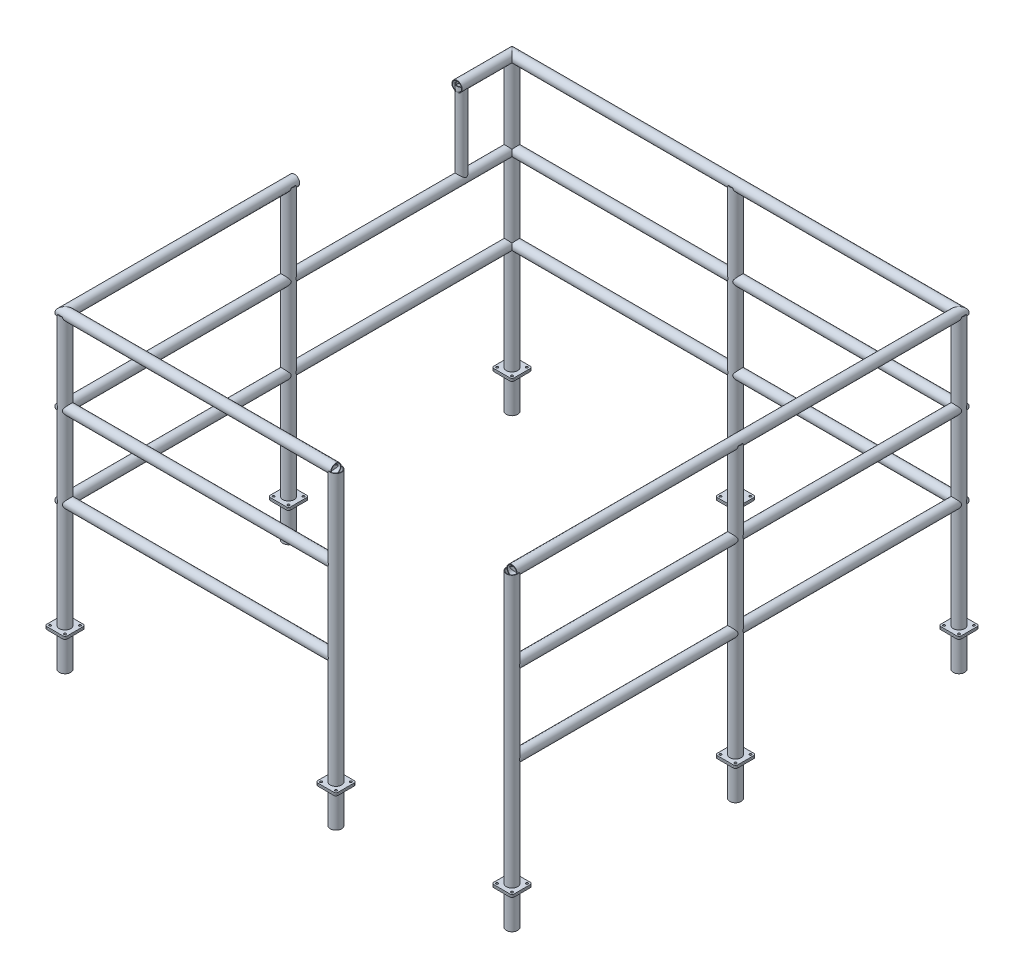
from build123d import *

# Parameters (mm, degrees)
SWEEP_THIN6_PROFILE_R   = 19
SWEEP_THIN6_PROFILE_R_2 = 17
LPATTERN1_COUNT         = 3
LPATTERN1_PITCH         = 300
SKETCH46_R              = 21
SKETCH46_R_2            = 19
BOSS_EXTRUDE5_DEPTH     = 1000
BOSS_EXTRUDE5_2_DEPTH   = 1000
BOSS_EXTRUDE5_3_DEPTH   = 1000
BOSS_EXTRUDE5_4_DEPTH   = 1000
BOSS_EXTRUDE5_5_DEPTH   = 1000
BOSS_EXTRUDE5_6_DEPTH   = 1000
BOSS_EXTRUDE5_7_DEPTH   = 1000
BOSS_EXTRUDE5_8_DEPTH   = 1000
SKETCH47_R              = 4
BOSS_EXTRUDE6_DEPTH     = 5
BOSS_EXTRUDE6_2_DEPTH   = 5
BOSS_EXTRUDE6_3_DEPTH   = 5
BOSS_EXTRUDE6_4_DEPTH   = 5
BOSS_EXTRUDE6_5_DEPTH   = 5
BOSS_EXTRUDE6_6_DEPTH   = 5
BOSS_EXTRUDE6_7_DEPTH   = 5
BOSS_EXTRUDE6_8_DEPTH   = 5
SKETCH55_R              = 4
BOSS_EXTRUDE7_DEPTH     = 5
BOSS_EXTRUDE7_2_DEPTH   = 5
BOSS_EXTRUDE7_3_DEPTH   = 5
BOSS_EXTRUDE7_4_DEPTH   = 5
BOSS_EXTRUDE7_5_DEPTH   = 5
BOSS_EXTRUDE7_6_DEPTH   = 5
BOSS_EXTRUDE7_7_DEPTH   = 5
BOSS_EXTRUDE7_8_DEPTH   = 5
SKETCH60_R              = 21
SKETCH60_R_2            = 19
BOSS_EXTRUDE8_DEPTH     = 130
BOSS_EXTRUDE8_2_DEPTH   = 130
BOSS_EXTRUDE8_3_DEPTH   = 130
BOSS_EXTRUDE8_4_DEPTH   = 130
BOSS_EXTRUDE8_5_DEPTH   = 130
BOSS_EXTRUDE8_6_DEPTH   = 130
BOSS_EXTRUDE8_7_DEPTH   = 130
BOSS_EXTRUDE8_8_DEPTH   = 130
CUT_EXTRUDE1_DEPTH      = 20
CUT_EXTRUDE1_DEPTH_BACK = 20
SKETCH64_W              = 38
SKETCH64_H              = 600
SKETCH66_R              = 17
SKETCH66_R_2            = 15
BOSS_EXTRUDE9_DEPTH     = 304


with BuildPart() as part:
    # Sweep-Thin6: sweep along a path in Sketch33
    with BuildLine(Plane(origin=(0, 0, 0), x_dir=(1, 0, 0), z_dir=(0, 1, 0))) as sweep_thin6_path:
        Line((825, -825), (825, 825))
        Line((825, 825), (-825, 825))
        Line((-825, 825), (-825, -825))
        Line((-825, -825), (175, -825))
    # Sweep-Thin6 profile (on start of the path) → Sweep-Thin6 (sweep)
    with BuildSketch(Plane(origin=(825, 0, 825), x_dir=(-1, 0, 0), z_dir=(0, 0, -1))):
        Circle(SWEEP_THIN6_PROFILE_R)
        Circle(SWEEP_THIN6_PROFILE_R_2, mode=Mode.SUBTRACT)
    sweep(path=sweep_thin6_path.line, transition=Transition.RIGHT)


with BuildPart() as lpattern1_1:
    # LPattern1: pattern copy
    add(part.part.moved(Location(Vector(0, -1, 0) * (1 * LPATTERN1_PITCH))))



with BuildPart() as lpattern1_2:
    # LPattern1: pattern copy
    add(part.part.moved(Location(Vector(0, -1, 0) * (2 * LPATTERN1_PITCH))))


with BuildPart() as body_4:
    # Sketch46 → Boss-Extrude5 (new body)
    with BuildSketch(Plane(origin=(0, 0, 0), x_dir=(1, 0, 0), z_dir=(0, 1, 0))):
        with Locations(Location((-825, 825, 0), (0, 0, 270))):
            Circle(SKETCH46_R)
        with Locations(Location((-825, 825, 0), (0, 0, 270))):
            Circle(SKETCH46_R_2, mode=Mode.SUBTRACT)
    extrude(amount=-BOSS_EXTRUDE5_DEPTH)


with BuildPart() as body_5:
    # Sketch46 → Boss-Extrude5 2 (new body)
    with BuildSketch(Plane(origin=(0, 0, 0), x_dir=(1, 0, 0), z_dir=(0, 1, 0))):
        with Locations(Location((0, 825, 0), (0, 0, 270))):
            Circle(SKETCH46_R)
        with Locations(Location((0, 825, 0), (0, 0, 270))):
            Circle(SKETCH46_R_2, mode=Mode.SUBTRACT)
    extrude(amount=-BOSS_EXTRUDE5_2_DEPTH)


with BuildPart() as body_6:
    # Sketch46 → Boss-Extrude5 3 (new body)
    with BuildSketch(Plane(origin=(0, 0, 0), x_dir=(1, 0, 0), z_dir=(0, 1, 0))):
        with Locations(Location((825, 825, 0), (0, 0, 270))):
            Circle(SKETCH46_R)
        with Locations(Location((825, 825, 0), (0, 0, 270))):
            Circle(SKETCH46_R_2, mode=Mode.SUBTRACT)
    extrude(amount=-BOSS_EXTRUDE5_3_DEPTH)


with BuildPart() as body_7:
    # Sketch46 → Boss-Extrude5 4 (new body)
    with BuildSketch(Plane(origin=(0, 0, 0), x_dir=(1, 0, 0), z_dir=(0, 1, 0))):
        with Locations(Location((825, 0, 0), (0, 0, 270))):
            Circle(SKETCH46_R)
        with Locations(Location((825, 0, 0), (0, 0, 270))):
            Circle(SKETCH46_R_2, mode=Mode.SUBTRACT)
    extrude(amount=-BOSS_EXTRUDE5_4_DEPTH)


with BuildPart() as body_8:
    # Sketch46 → Boss-Extrude5 5 (new body)
    with BuildSketch(Plane(origin=(0, 0, 0), x_dir=(1, 0, 0), z_dir=(0, 1, 0))):
        with Locations(Location((825, -825, 0), (0, 0, 270))):
            Circle(SKETCH46_R)
        with Locations(Location((825, -825, 0), (0, 0, 270))):
            Circle(SKETCH46_R_2, mode=Mode.SUBTRACT)
    extrude(amount=-BOSS_EXTRUDE5_5_DEPTH)


with BuildPart() as body_9:
    # Sketch46 → Boss-Extrude5 6 (new body)
    with BuildSketch(Plane(origin=(0, 0, 0), x_dir=(1, 0, 0), z_dir=(0, 1, 0))):
        with Locations(Location((-825, 0, 0), (0, 0, 270))):
            Circle(SKETCH46_R)
        with Locations(Location((-825, 0, 0), (0, 0, 270))):
            Circle(SKETCH46_R_2, mode=Mode.SUBTRACT)
    extrude(amount=-BOSS_EXTRUDE5_6_DEPTH)


with BuildPart() as body_10:
    # Sketch46 → Boss-Extrude5 7 (new body)
    with BuildSketch(Plane(origin=(0, 0, 0), x_dir=(1, 0, 0), z_dir=(0, 1, 0))):
        with Locations(Location((-825, -825, 0), (0, 0, 270))):
            Circle(SKETCH46_R)
        with Locations(Location((-825, -825, 0), (0, 0, 270))):
            Circle(SKETCH46_R_2, mode=Mode.SUBTRACT)
    extrude(amount=-BOSS_EXTRUDE5_7_DEPTH)


with BuildPart() as body_11:
    # Sketch46 → Boss-Extrude5 8 (new body)
    with BuildSketch(Plane(origin=(0, 0, 0), x_dir=(1, 0, 0), z_dir=(0, 1, 0))):
        with Locations(Location((175, -825, 0), (0, 0, 270))):
            Circle(SKETCH46_R)
        with Locations(Location((175, -825, 0), (0, 0, 270))):
            Circle(SKETCH46_R_2, mode=Mode.SUBTRACT)
    extrude(amount=-BOSS_EXTRUDE5_8_DEPTH)


with BuildPart() as body_12:
    # Sketch47 → Boss-Extrude6 (new body)
    with BuildSketch(Plane.XZ.offset(1000)):
        with BuildLine():
            Line((37.5, -795.5), (37.5, -854.5))
            ThreePointArc((37.5, -854.5), (35.156854249, -860.156854249), (29.5, -862.5))
            Line((29.5, -862.5), (-29.5, -862.5))
            ThreePointArc((-29.5, -862.5), (-35.156854249, -860.156854249), (-37.5, -854.5))
            Line((-37.5, -854.5), (-37.5, -795.5))
            ThreePointArc((-37.5, -795.5), (-35.156854249, -789.843145751), (-29.5, -787.5))
            Line((-29.5, -787.5), (29.5, -787.5))
            ThreePointArc((29.5, -787.5), (35.156854249, -789.843145751), (37.5, -795.5))
        make_face()
        with Locations(Location((27.5, -797.5, 0), (0, 0, 270))):
            Circle(SKETCH47_R, mode=Mode.SUBTRACT)
        with Locations(Location((27.5, -852.5, 0), (0, 0, 270))):
            Circle(SKETCH47_R, mode=Mode.SUBTRACT)
        with Locations(Location((-27.5, -797.5, 0), (0, 0, 270))):
            Circle(SKETCH47_R, mode=Mode.SUBTRACT)
        with Locations(Location((-27.5, -852.5, 0), (0, 0, 270))):
            Circle(SKETCH47_R, mode=Mode.SUBTRACT)
    extrude(amount=BOSS_EXTRUDE6_DEPTH)


with BuildPart() as body_13:
    # Sketch47 → Boss-Extrude6 2 (new body)
    with BuildSketch(Plane.XZ.offset(1000)):
        with BuildLine():
            Line((-795.5, -787.5), (-854.5, -787.5))
            ThreePointArc((-854.5, -787.5), (-860.156854249, -789.843145751), (-862.5, -795.5))
            Line((-862.5, -795.5), (-862.5, -854.5))
            ThreePointArc((-862.5, -854.5), (-860.156854249, -860.156854249), (-854.5, -862.5))
            Line((-854.5, -862.5), (-795.5, -862.5))
            ThreePointArc((-795.5, -862.5), (-789.843145751, -860.156854249), (-787.5, -854.5))
            Line((-787.5, -854.5), (-787.5, -795.5))
            ThreePointArc((-787.5, -795.5), (-789.843145751, -789.843145751), (-795.5, -787.5))
        make_face()
        with Locations(Location((-797.5, -797.5, 0), (0, 0, 270))):
            Circle(SKETCH47_R, mode=Mode.SUBTRACT)
        with Locations(Location((-852.5, -797.5, 0), (0, 0, 270))):
            Circle(SKETCH47_R, mode=Mode.SUBTRACT)
        with Locations(Location((-852.5, -852.5, 0), (0, 0, 270))):
            Circle(SKETCH47_R, mode=Mode.SUBTRACT)
        with Locations(Location((-797.5, -852.5, 0), (0, 0, 270))):
            Circle(SKETCH47_R, mode=Mode.SUBTRACT)
    extrude(amount=BOSS_EXTRUDE6_2_DEPTH)


with BuildPart() as body_14:
    # Sketch47 → Boss-Extrude6 3 (new body)
    with BuildSketch(Plane.XZ.offset(1000)):
        with BuildLine():
            Line((862.5, -795.5), (862.5, -854.5))
            ThreePointArc((862.5, -854.5), (860.156854249, -860.156854249), (854.5, -862.5))
            Line((854.5, -862.5), (795.5, -862.5))
            ThreePointArc((795.5, -862.5), (789.843145751, -860.156854249), (787.5, -854.5))
            Line((787.5, -854.5), (787.5, -795.5))
            ThreePointArc((787.5, -795.5), (789.843145751, -789.843145751), (795.5, -787.5))
            Line((795.5, -787.5), (854.5, -787.5))
            ThreePointArc((854.5, -787.5), (860.156854249, -789.843145751), (862.5, -795.5))
        make_face()
        with Locations(Location((852.5, -797.5, 0), (0, 0, 270))):
            Circle(SKETCH47_R, mode=Mode.SUBTRACT)
        with Locations(Location((852.5, -852.5, 0), (0, 0, 270))):
            Circle(SKETCH47_R, mode=Mode.SUBTRACT)
        with Locations(Location((797.5, -797.5, 0), (0, 0, 270))):
            Circle(SKETCH47_R, mode=Mode.SUBTRACT)
        with Locations(Location((797.5, -852.5, 0), (0, 0, 270))):
            Circle(SKETCH47_R, mode=Mode.SUBTRACT)
    extrude(amount=BOSS_EXTRUDE6_3_DEPTH)


with BuildPart() as body_15:
    # Sketch47 → Boss-Extrude6 4 (new body)
    with BuildSketch(Plane.XZ.offset(1000)):
        with BuildLine():
            Line((862.5, 29.5), (862.5, -29.5))
            ThreePointArc((862.5, -29.5), (860.156854249, -35.156854249), (854.5, -37.5))
            Line((854.5, -37.5), (795.5, -37.5))
            ThreePointArc((795.5, -37.5), (789.843145751, -35.156854249), (787.5, -29.5))
            Line((787.5, -29.5), (787.5, 29.5))
            ThreePointArc((787.5, 29.5), (789.843145751, 35.156854249), (795.5, 37.5))
            Line((795.5, 37.5), (854.5, 37.5))
            ThreePointArc((854.5, 37.5), (860.156854249, 35.156854249), (862.5, 29.5))
        make_face()
        with Locations(Location((852.5, 27.5, 0), (0, 0, 270))):
            Circle(SKETCH47_R, mode=Mode.SUBTRACT)
        with Locations(Location((852.5, -27.5, 0), (0, 0, 270))):
            Circle(SKETCH47_R, mode=Mode.SUBTRACT)
        with Locations(Location((797.5, 27.5, 0), (0, 0, 270))):
            Circle(SKETCH47_R, mode=Mode.SUBTRACT)
        with Locations(Location((797.5, -27.5, 0), (0, 0, 270))):
            Circle(SKETCH47_R, mode=Mode.SUBTRACT)
    extrude(amount=BOSS_EXTRUDE6_4_DEPTH)


with BuildPart() as body_16:
    # Sketch47 → Boss-Extrude6 5 (new body)
    with BuildSketch(Plane.XZ.offset(1000)):
        with BuildLine():
            Line((862.5, 854.5), (862.5, 795.5))
            ThreePointArc((862.5, 795.5), (860.156854249, 789.843145751), (854.5, 787.5))
            Line((854.5, 787.5), (795.5, 787.5))
            ThreePointArc((795.5, 787.5), (789.843145751, 789.843145751), (787.5, 795.5))
            Line((787.5, 795.5), (787.5, 854.5))
            ThreePointArc((787.5, 854.5), (789.843145751, 860.156854249), (795.5, 862.5))
            Line((795.5, 862.5), (854.5, 862.5))
            ThreePointArc((854.5, 862.5), (860.156854249, 860.156854249), (862.5, 854.5))
        make_face()
        with Locations(Location((852.5, 852.5, 0), (0, 0, 270))):
            Circle(SKETCH47_R, mode=Mode.SUBTRACT)
        with Locations(Location((852.5, 797.5, 0), (0, 0, 270))):
            Circle(SKETCH47_R, mode=Mode.SUBTRACT)
        with Locations(Location((797.5, 852.5, 0), (0, 0, 270))):
            Circle(SKETCH47_R, mode=Mode.SUBTRACT)
        with Locations(Location((797.5, 797.5, 0), (0, 0, 270))):
            Circle(SKETCH47_R, mode=Mode.SUBTRACT)
    extrude(amount=BOSS_EXTRUDE6_5_DEPTH)


with BuildPart() as body_17:
    # Sketch47 → Boss-Extrude6 6 (new body)
    with BuildSketch(Plane.XZ.offset(1000)):
        with BuildLine():
            Line((-787.5, 29.5), (-787.5, -29.5))
            ThreePointArc((-787.5, -29.5), (-789.843145751, -35.156854249), (-795.5, -37.5))
            Line((-795.5, -37.5), (-854.5, -37.5))
            ThreePointArc((-854.5, -37.5), (-860.156854249, -35.156854249), (-862.5, -29.5))
            Line((-862.5, -29.5), (-862.5, 29.5))
            ThreePointArc((-862.5, 29.5), (-860.156854249, 35.156854249), (-854.5, 37.5))
            Line((-854.5, 37.5), (-795.5, 37.5))
            ThreePointArc((-795.5, 37.5), (-789.843145751, 35.156854249), (-787.5, 29.5))
        make_face()
        with Locations(Location((-797.5, 27.5, 0), (0, 0, 270))):
            Circle(SKETCH47_R, mode=Mode.SUBTRACT)
        with Locations(Location((-797.5, -27.5, 0), (0, 0, 270))):
            Circle(SKETCH47_R, mode=Mode.SUBTRACT)
        with Locations(Location((-852.5, 27.5, 0), (0, 0, 270))):
            Circle(SKETCH47_R, mode=Mode.SUBTRACT)
        with Locations(Location((-852.5, -27.5, 0), (0, 0, 270))):
            Circle(SKETCH47_R, mode=Mode.SUBTRACT)
    extrude(amount=BOSS_EXTRUDE6_6_DEPTH)


with BuildPart() as body_18:
    # Sketch47 → Boss-Extrude6 7 (new body)
    with BuildSketch(Plane.XZ.offset(1000)):
        with BuildLine():
            Line((-787.5, 854.5), (-787.5, 795.5))
            ThreePointArc((-787.5, 795.5), (-789.843145751, 789.843145751), (-795.5, 787.5))
            Line((-795.5, 787.5), (-854.5, 787.5))
            ThreePointArc((-854.5, 787.5), (-860.156854249, 789.843145751), (-862.5, 795.5))
            Line((-862.5, 795.5), (-862.5, 854.5))
            ThreePointArc((-862.5, 854.5), (-860.156854249, 860.156854249), (-854.5, 862.5))
            Line((-854.5, 862.5), (-795.5, 862.5))
            ThreePointArc((-795.5, 862.5), (-789.843145751, 860.156854249), (-787.5, 854.5))
        make_face()
        with Locations(Location((-797.5, 852.5, 0), (0, 0, 270))):
            Circle(SKETCH47_R, mode=Mode.SUBTRACT)
        with Locations(Location((-797.5, 797.5, 0), (0, 0, 270))):
            Circle(SKETCH47_R, mode=Mode.SUBTRACT)
        with Locations(Location((-852.5, 852.5, 0), (0, 0, 270))):
            Circle(SKETCH47_R, mode=Mode.SUBTRACT)
        with Locations(Location((-852.5, 797.5, 0), (0, 0, 270))):
            Circle(SKETCH47_R, mode=Mode.SUBTRACT)
    extrude(amount=BOSS_EXTRUDE6_7_DEPTH)


with BuildPart() as body_19:
    # Sketch47 → Boss-Extrude6 8 (new body)
    with BuildSketch(Plane.XZ.offset(1000)):
        with BuildLine():
            Line((212.5, 854.5), (212.5, 795.5))
            ThreePointArc((212.5, 795.5), (210.156854249, 789.843145751), (204.5, 787.5))
            Line((204.5, 787.5), (145.5, 787.5))
            ThreePointArc((145.5, 787.5), (139.843145751, 789.843145751), (137.5, 795.5))
            Line((137.5, 795.5), (137.5, 854.5))
            ThreePointArc((137.5, 854.5), (139.843145751, 860.156854249), (145.5, 862.5))
            Line((145.5, 862.5), (204.5, 862.5))
            ThreePointArc((204.5, 862.5), (210.156854249, 860.156854249), (212.5, 854.5))
        make_face()
        with Locations(Location((202.5, 852.5, 0), (0, 0, 270))):
            Circle(SKETCH47_R, mode=Mode.SUBTRACT)
        with Locations(Location((202.5, 797.5, 0), (0, 0, 270))):
            Circle(SKETCH47_R, mode=Mode.SUBTRACT)
        with Locations(Location((147.5, 797.5, 0), (0, 0, 270))):
            Circle(SKETCH47_R, mode=Mode.SUBTRACT)
        with Locations(Location((147.5, 852.5, 0), (0, 0, 270))):
            Circle(SKETCH47_R, mode=Mode.SUBTRACT)
    extrude(amount=BOSS_EXTRUDE6_8_DEPTH)


with BuildPart() as body_20:
    # Sketch55 → Boss-Extrude7 (new body)
    with BuildSketch(Plane.XZ.offset(1005)):
        with BuildLine():
            Line((-37.5, -795.5), (-37.5, -854.5))
            ThreePointArc((-37.5, -854.5), (-35.156854249, -860.156854249), (-29.5, -862.5))
            Line((-29.5, -862.5), (29.5, -862.5))
            ThreePointArc((29.5, -862.5), (35.156854249, -860.156854249), (37.5, -854.5))
            Line((37.5, -854.5), (37.5, -795.5))
            ThreePointArc((37.5, -795.5), (35.156854249, -789.843145751), (29.5, -787.5))
            Line((29.5, -787.5), (-29.5, -787.5))
            ThreePointArc((-29.5, -787.5), (-35.156854249, -789.843145751), (-37.5, -795.5))
        make_face()
        with Locations(Location((27.5, -852.5, 0), (0, 0, 270))):
            Circle(SKETCH55_R, mode=Mode.SUBTRACT)
        with Locations(Location((27.5, -797.5, 0), (0, 0, 270))):
            Circle(SKETCH55_R, mode=Mode.SUBTRACT)
        with Locations(Location((-27.5, -797.5, 0), (0, 0, 270))):
            Circle(SKETCH55_R, mode=Mode.SUBTRACT)
        with Locations(Location((-27.5, -852.5, 0), (0, 0, 270))):
            Circle(SKETCH55_R, mode=Mode.SUBTRACT)
    extrude(amount=BOSS_EXTRUDE7_DEPTH)


with BuildPart() as body_21:
    # Sketch55 → Boss-Extrude7 2 (new body)
    with BuildSketch(Plane.XZ.offset(1005)):
        with BuildLine():
            Line((787.5, -795.5), (787.5, -854.5))
            ThreePointArc((787.5, -854.5), (789.843145751, -860.156854249), (795.5, -862.5))
            Line((795.5, -862.5), (854.5, -862.5))
            ThreePointArc((854.5, -862.5), (860.156854249, -860.156854249), (862.5, -854.5))
            Line((862.5, -854.5), (862.5, -795.5))
            ThreePointArc((862.5, -795.5), (860.156854249, -789.843145751), (854.5, -787.5))
            Line((854.5, -787.5), (795.5, -787.5))
            ThreePointArc((795.5, -787.5), (789.843145751, -789.843145751), (787.5, -795.5))
        make_face()
        with Locations(Location((852.5, -852.5, 0), (0, 0, 270))):
            Circle(SKETCH55_R, mode=Mode.SUBTRACT)
        with Locations(Location((852.5, -797.5, 0), (0, 0, 270))):
            Circle(SKETCH55_R, mode=Mode.SUBTRACT)
        with Locations(Location((797.5, -797.5, 0), (0, 0, 270))):
            Circle(SKETCH55_R, mode=Mode.SUBTRACT)
        with Locations(Location((797.5, -852.5, 0), (0, 0, 270))):
            Circle(SKETCH55_R, mode=Mode.SUBTRACT)
    extrude(amount=BOSS_EXTRUDE7_2_DEPTH)


with BuildPart() as body_22:
    # Sketch55 → Boss-Extrude7 3 (new body)
    with BuildSketch(Plane.XZ.offset(1005)):
        with BuildLine():
            Line((787.5, 29.5), (787.5, -29.5))
            ThreePointArc((787.5, -29.5), (789.843145751, -35.156854249), (795.5, -37.5))
            Line((795.5, -37.5), (854.5, -37.5))
            ThreePointArc((854.5, -37.5), (860.156854249, -35.156854249), (862.5, -29.5))
            Line((862.5, -29.5), (862.5, 29.5))
            ThreePointArc((862.5, 29.5), (860.156854249, 35.156854249), (854.5, 37.5))
            Line((854.5, 37.5), (795.5, 37.5))
            ThreePointArc((795.5, 37.5), (789.843145751, 35.156854249), (787.5, 29.5))
        make_face()
        with Locations(Location((852.5, -27.5, 0), (0, 0, 270))):
            Circle(SKETCH55_R, mode=Mode.SUBTRACT)
        with Locations(Location((852.5, 27.5, 0), (0, 0, 270))):
            Circle(SKETCH55_R, mode=Mode.SUBTRACT)
        with Locations(Location((797.5, 27.5, 0), (0, 0, 270))):
            Circle(SKETCH55_R, mode=Mode.SUBTRACT)
        with Locations(Location((797.5, -27.5, 0), (0, 0, 270))):
            Circle(SKETCH55_R, mode=Mode.SUBTRACT)
    extrude(amount=BOSS_EXTRUDE7_3_DEPTH)


with BuildPart() as body_23:
    # Sketch55 → Boss-Extrude7 4 (new body)
    with BuildSketch(Plane.XZ.offset(1005)):
        with BuildLine():
            Line((787.5, 854.5), (787.5, 795.5))
            ThreePointArc((787.5, 795.5), (789.843145751, 789.843145751), (795.5, 787.5))
            Line((795.5, 787.5), (854.5, 787.5))
            ThreePointArc((854.5, 787.5), (860.156854249, 789.843145751), (862.5, 795.5))
            Line((862.5, 795.5), (862.5, 854.5))
            ThreePointArc((862.5, 854.5), (860.156854249, 860.156854249), (854.5, 862.5))
            Line((854.5, 862.5), (795.5, 862.5))
            ThreePointArc((795.5, 862.5), (789.843145751, 860.156854249), (787.5, 854.5))
        make_face()
        with Locations(Location((852.5, 797.5, 0), (0, 0, 270))):
            Circle(SKETCH55_R, mode=Mode.SUBTRACT)
        with Locations(Location((852.5, 852.5, 0), (0, 0, 270))):
            Circle(SKETCH55_R, mode=Mode.SUBTRACT)
        with Locations(Location((797.5, 852.5, 0), (0, 0, 270))):
            Circle(SKETCH55_R, mode=Mode.SUBTRACT)
        with Locations(Location((797.5, 797.5, 0), (0, 0, 270))):
            Circle(SKETCH55_R, mode=Mode.SUBTRACT)
    extrude(amount=BOSS_EXTRUDE7_4_DEPTH)


with BuildPart() as body_24:
    # Sketch55 → Boss-Extrude7 5 (new body)
    with BuildSketch(Plane.XZ.offset(1005)):
        with BuildLine():
            Line((137.5, 854.5), (137.5, 795.5))
            ThreePointArc((137.5, 795.5), (139.843145751, 789.843145751), (145.5, 787.5))
            Line((145.5, 787.5), (204.5, 787.5))
            ThreePointArc((204.5, 787.5), (210.156854249, 789.843145751), (212.5, 795.5))
            Line((212.5, 795.5), (212.5, 854.5))
            ThreePointArc((212.5, 854.5), (210.156854249, 860.156854249), (204.5, 862.5))
            Line((204.5, 862.5), (145.5, 862.5))
            ThreePointArc((145.5, 862.5), (139.843145751, 860.156854249), (137.5, 854.5))
        make_face()
        with Locations(Location((202.5, 797.5, 0), (0, 0, 270))):
            Circle(SKETCH55_R, mode=Mode.SUBTRACT)
        with Locations(Location((202.5, 852.5, 0), (0, 0, 270))):
            Circle(SKETCH55_R, mode=Mode.SUBTRACT)
        with Locations(Location((147.5, 852.5, 0), (0, 0, 270))):
            Circle(SKETCH55_R, mode=Mode.SUBTRACT)
        with Locations(Location((147.5, 797.5, 0), (0, 0, 270))):
            Circle(SKETCH55_R, mode=Mode.SUBTRACT)
    extrude(amount=BOSS_EXTRUDE7_5_DEPTH)


with BuildPart() as body_25:
    # Sketch55 → Boss-Extrude7 6 (new body)
    with BuildSketch(Plane.XZ.offset(1005)):
        with BuildLine():
            Line((-862.5, 854.5), (-862.5, 795.5))
            ThreePointArc((-862.5, 795.5), (-860.156854249, 789.843145751), (-854.5, 787.5))
            Line((-854.5, 787.5), (-795.5, 787.5))
            ThreePointArc((-795.5, 787.5), (-789.843145751, 789.843145751), (-787.5, 795.5))
            Line((-787.5, 795.5), (-787.5, 854.5))
            ThreePointArc((-787.5, 854.5), (-789.843145751, 860.156854249), (-795.5, 862.5))
            Line((-795.5, 862.5), (-854.5, 862.5))
            ThreePointArc((-854.5, 862.5), (-860.156854249, 860.156854249), (-862.5, 854.5))
        make_face()
        with Locations(Location((-797.5, 797.5, 0), (0, 0, 270))):
            Circle(SKETCH55_R, mode=Mode.SUBTRACT)
        with Locations(Location((-797.5, 852.5, 0), (0, 0, 270))):
            Circle(SKETCH55_R, mode=Mode.SUBTRACT)
        with Locations(Location((-852.5, 852.5, 0), (0, 0, 270))):
            Circle(SKETCH55_R, mode=Mode.SUBTRACT)
        with Locations(Location((-852.5, 797.5, 0), (0, 0, 270))):
            Circle(SKETCH55_R, mode=Mode.SUBTRACT)
    extrude(amount=BOSS_EXTRUDE7_6_DEPTH)


with BuildPart() as body_26:
    # Sketch55 → Boss-Extrude7 7 (new body)
    with BuildSketch(Plane.XZ.offset(1005)):
        with BuildLine():
            Line((-862.5, 29.5), (-862.5, -29.5))
            ThreePointArc((-862.5, -29.5), (-860.156854249, -35.156854249), (-854.5, -37.5))
            Line((-854.5, -37.5), (-795.5, -37.5))
            ThreePointArc((-795.5, -37.5), (-789.843145751, -35.156854249), (-787.5, -29.5))
            Line((-787.5, -29.5), (-787.5, 29.5))
            ThreePointArc((-787.5, 29.5), (-789.843145751, 35.156854249), (-795.5, 37.5))
            Line((-795.5, 37.5), (-854.5, 37.5))
            ThreePointArc((-854.5, 37.5), (-860.156854249, 35.156854249), (-862.5, 29.5))
        make_face()
        with Locations(Location((-797.5, -27.5, 0), (0, 0, 270))):
            Circle(SKETCH55_R, mode=Mode.SUBTRACT)
        with Locations(Location((-797.5, 27.5, 0), (0, 0, 270))):
            Circle(SKETCH55_R, mode=Mode.SUBTRACT)
        with Locations(Location((-852.5, 27.5, 0), (0, 0, 270))):
            Circle(SKETCH55_R, mode=Mode.SUBTRACT)
        with Locations(Location((-852.5, -27.5, 0), (0, 0, 270))):
            Circle(SKETCH55_R, mode=Mode.SUBTRACT)
    extrude(amount=BOSS_EXTRUDE7_7_DEPTH)


with BuildPart() as body_27:
    # Sketch55 → Boss-Extrude7 8 (new body)
    with BuildSketch(Plane.XZ.offset(1005)):
        with BuildLine():
            Line((-862.5, -795.5), (-862.5, -854.5))
            ThreePointArc((-862.5, -854.5), (-860.156854249, -860.156854249), (-854.5, -862.5))
            Line((-854.5, -862.5), (-795.5, -862.5))
            ThreePointArc((-795.5, -862.5), (-789.843145751, -860.156854249), (-787.5, -854.5))
            Line((-787.5, -854.5), (-787.5, -795.5))
            ThreePointArc((-787.5, -795.5), (-789.843145751, -789.843145751), (-795.5, -787.5))
            Line((-795.5, -787.5), (-854.5, -787.5))
            ThreePointArc((-854.5, -787.5), (-860.156854249, -789.843145751), (-862.5, -795.5))
        make_face()
        with Locations(Location((-797.5, -852.5, 0), (0, 0, 270))):
            Circle(SKETCH55_R, mode=Mode.SUBTRACT)
        with Locations(Location((-797.5, -797.5, 0), (0, 0, 270))):
            Circle(SKETCH55_R, mode=Mode.SUBTRACT)
        with Locations(Location((-852.5, -797.5, 0), (0, 0, 270))):
            Circle(SKETCH55_R, mode=Mode.SUBTRACT)
        with Locations(Location((-852.5, -852.5, 0), (0, 0, 270))):
            Circle(SKETCH55_R, mode=Mode.SUBTRACT)
    extrude(amount=BOSS_EXTRUDE7_8_DEPTH)


with BuildPart() as body_28:
    # Sketch60 → Boss-Extrude8 (new body)
    with BuildSketch(Plane.XZ.offset(1010)):
        with Locations(Location((825, 825, 0), (0, 0, 270))):
            Circle(SKETCH60_R)
        with Locations(Location((825, 825, 0), (0, 0, 270))):
            Circle(SKETCH60_R_2, mode=Mode.SUBTRACT)
    extrude(amount=BOSS_EXTRUDE8_DEPTH)


with BuildPart() as body_29:
    # Sketch60 → Boss-Extrude8 2 (new body)
    with BuildSketch(Plane.XZ.offset(1010)):
        with Locations(Location((825, 0, 0), (0, 0, 270))):
            Circle(SKETCH60_R)
        with Locations(Location((825, 0, 0), (0, 0, 270))):
            Circle(SKETCH60_R_2, mode=Mode.SUBTRACT)
    extrude(amount=BOSS_EXTRUDE8_2_DEPTH)


with BuildPart() as body_30:
    # Sketch60 → Boss-Extrude8 3 (new body)
    with BuildSketch(Plane.XZ.offset(1010)):
        with Locations(Location((825, -825, 0), (0, 0, 270))):
            Circle(SKETCH60_R)
        with Locations(Location((825, -825, 0), (0, 0, 270))):
            Circle(SKETCH60_R_2, mode=Mode.SUBTRACT)
    extrude(amount=BOSS_EXTRUDE8_3_DEPTH)


with BuildPart() as body_31:
    # Sketch60 → Boss-Extrude8 4 (new body)
    with BuildSketch(Plane.XZ.offset(1010)):
        with Locations(Location((0, -825, 0), (0, 0, 270))):
            Circle(SKETCH60_R)
        with Locations(Location((0, -825, 0), (0, 0, 270))):
            Circle(SKETCH60_R_2, mode=Mode.SUBTRACT)
    extrude(amount=BOSS_EXTRUDE8_4_DEPTH)


with BuildPart() as body_32:
    # Sketch60 → Boss-Extrude8 5 (new body)
    with BuildSketch(Plane.XZ.offset(1010)):
        with Locations(Location((-825, -825, 0), (0, 0, 270))):
            Circle(SKETCH60_R)
        with Locations(Location((-825, -825, 0), (0, 0, 270))):
            Circle(SKETCH60_R_2, mode=Mode.SUBTRACT)
    extrude(amount=BOSS_EXTRUDE8_5_DEPTH)


with BuildPart() as body_33:
    # Sketch60 → Boss-Extrude8 6 (new body)
    with BuildSketch(Plane.XZ.offset(1010)):
        with Locations(Location((-825, 0, 0), (0, 0, 270))):
            Circle(SKETCH60_R)
        with Locations(Location((-825, 0, 0), (0, 0, 270))):
            Circle(SKETCH60_R_2, mode=Mode.SUBTRACT)
    extrude(amount=BOSS_EXTRUDE8_6_DEPTH)


with BuildPart() as body_34:
    # Sketch60 → Boss-Extrude8 7 (new body)
    with BuildSketch(Plane.XZ.offset(1010)):
        with Locations(Location((-825, 825, 0), (0, 0, 270))):
            Circle(SKETCH60_R)
        with Locations(Location((-825, 825, 0), (0, 0, 270))):
            Circle(SKETCH60_R_2, mode=Mode.SUBTRACT)
    extrude(amount=BOSS_EXTRUDE8_7_DEPTH)


with BuildPart() as body_35:
    # Sketch60 → Boss-Extrude8 8 (new body)
    with BuildSketch(Plane.XZ.offset(1010)):
        with Locations(Location((175, 825, 0), (0, 0, 270))):
            Circle(SKETCH60_R)
        with Locations(Location((175, 825, 0), (0, 0, 270))):
            Circle(SKETCH60_R_2, mode=Mode.SUBTRACT)
    extrude(amount=BOSS_EXTRUDE8_8_DEPTH)


with BuildPart() as part_1:
    add(part.part)

    # Sketch64 → Cut-Extrude1 (cut, two sides: drawn at the far end of the back side and taken through both)
    with BuildSketch(Plane(origin=(0, 0, 0), x_dir=(1, 0, 0), z_dir=(0, 1, 0)).offset(-CUT_EXTRUDE1_DEPTH_BACK)):
        with Locations((-825, 322)):
            Rectangle(SKETCH64_W, SKETCH64_H)
    extrude(amount=CUT_EXTRUDE1_DEPTH + CUT_EXTRUDE1_DEPTH_BACK, mode=Mode.SUBTRACT)


with BuildPart() as cut_extrude1_piece_1:
    # of the separate pieces the step leaves, piece 1, a body of its own (cut_extrude1_pieces)
    add(part_1.part.solids().sort_by_distance((806, 0, 825))[0])


with BuildPart() as cut_extrude1_piece_2:
    # of the separate pieces the step leaves, piece 2, a body of its own (cut_extrude1_pieces)
    add(part_1.part.solids().sort_by_distance((-806, 0, -22))[0])


with BuildPart() as lpattern1_1_1:
    add(lpattern1_1.part)

    add(cut_extrude1_piece_1.part)  # Boss-Extrude9 merges Cut-Extrude1 piece 1
    # Sketch66 → Boss-Extrude9 (add)
    with BuildSketch(Plane(origin=(0, 0, 0), x_dir=(1, 0, 0), z_dir=(0, 1, 0))):
        with Locations(Location((-825.168421092, 639, 0), (0, 0, 270))):
            Circle(SKETCH66_R)
        with Locations(Location((-825.168421092, 639, 0), (0, 0, 270))):
            Circle(SKETCH66_R_2, mode=Mode.SUBTRACT)
    extrude(amount=-BOSS_EXTRUDE9_DEPTH)


solid = Compound([lpattern1_2.part, body_4.part, body_5.part, body_6.part, body_7.part, body_8.part, body_9.part, body_10.part, body_11.part, body_12.part, body_13.part, body_14.part, body_15.part, body_16.part, body_17.part, body_18.part, body_19.part, body_20.part, body_21.part, body_22.part, body_23.part, body_24.part, body_25.part, body_26.part, body_27.part, body_28.part, body_29.part, body_30.part, body_31.part, body_32.part, body_33.part, body_34.part, body_35.part, cut_extrude1_piece_2.part, lpattern1_1_1.part])
